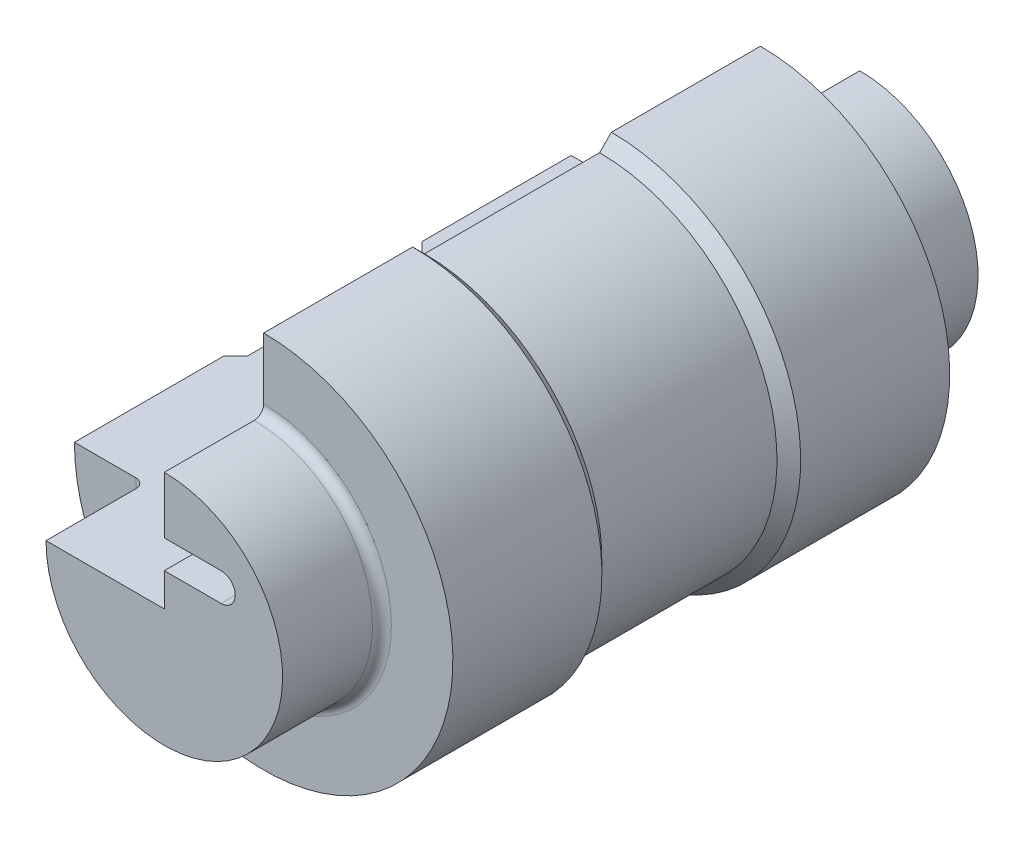
from build123d import *

# Parameters (mm, degrees)
ENL_V_MAT_EXTRU_1_DEPTH      = 93.748315349
ENL_V_MAT_EXTRU_1_DEPTH_BACK = 93.748315349
ESQUISSE3_W                  = 49.590285902
ESQUISSE3_H                  = 55.327856271
ENL_V_MAT_EXTRU_2_DEPTH      = 93.748315349
ENL_V_MAT_EXTRU_2_DEPTH_BACK = 93.748315349


with BuildPart() as part:
    # Esquisse1 → Révolution1 (revolve)
    with BuildSketch(Plane(origin=(0, 0, 0), x_dir=(0, 0, -1), z_dir=(1, 0, 0)), mode=Mode.PRIVATE) as r_volution1_sk:
        with BuildLine():
            Line((-73.5, 0), (73.5, 0))
            Line((73.5, 0), (73.5, 25))
            Line((73.5, 25), (54.5, 25))
            ThreePointArc((54.5, 25), (53.085786438, 25.585786438), (52.5, 27))
            Line((52.5, 27), (52.5, 40))
            Line((52.5, 40), (21, 40))
            Line((21, 40), (18.5, 37.5))
            Line((18.5, 37.5), (-18.5, 37.5))
            Line((-18.5, 37.5), (-21, 40))
            Line((-21, 40), (-52.5, 40))
            Line((-52.5, 40), (-52.5, 27))
            ThreePointArc((-52.5, 27), (-53.085786438, 25.585786438), (-54.5, 25))
            Line((-54.5, 25), (-73.5, 25))
            Line((-73.5, 25), (-73.5, 0))
        make_face()
    revolve(r_volution1_sk.sketch.rotate(Axis((0, 0, 73.5), (0, 0, -1)), 90), axis=Axis((0, 0, 73.5), (0, 0, -1)))

    # Esquisse3 → Enlèv. mat.-Extru.1 (cut, two sides: drawn at the far end of the back side and taken through both)
    with BuildSketch(Plane.XY.offset(-ENL_V_MAT_EXTRU_1_DEPTH_BACK)):
        with Locations((-24.795142951, 27.663928136)):
            Rectangle(ESQUISSE3_W, ESQUISSE3_H)
    extrude(amount=ENL_V_MAT_EXTRU_1_DEPTH + ENL_V_MAT_EXTRU_1_DEPTH_BACK, mode=Mode.SUBTRACT)

    # Esquisse4 → Enlèv. mat.-Extru.2 (cut, two sides: drawn at the far end of the back side and taken through both)
    with BuildSketch(Plane.XY.offset(-ENL_V_MAT_EXTRU_2_DEPTH_BACK)):
        with BuildLine():
            Line((0, 7), (12, 7))
            ThreePointArc((12, 7), (15, 10), (12, 13))
            Line((12, 13), (0, 13))
            Line((0, 13), (0, 7))
        make_face()
    extrude(amount=ENL_V_MAT_EXTRU_2_DEPTH + ENL_V_MAT_EXTRU_2_DEPTH_BACK, mode=Mode.SUBTRACT)


solid = part.part
